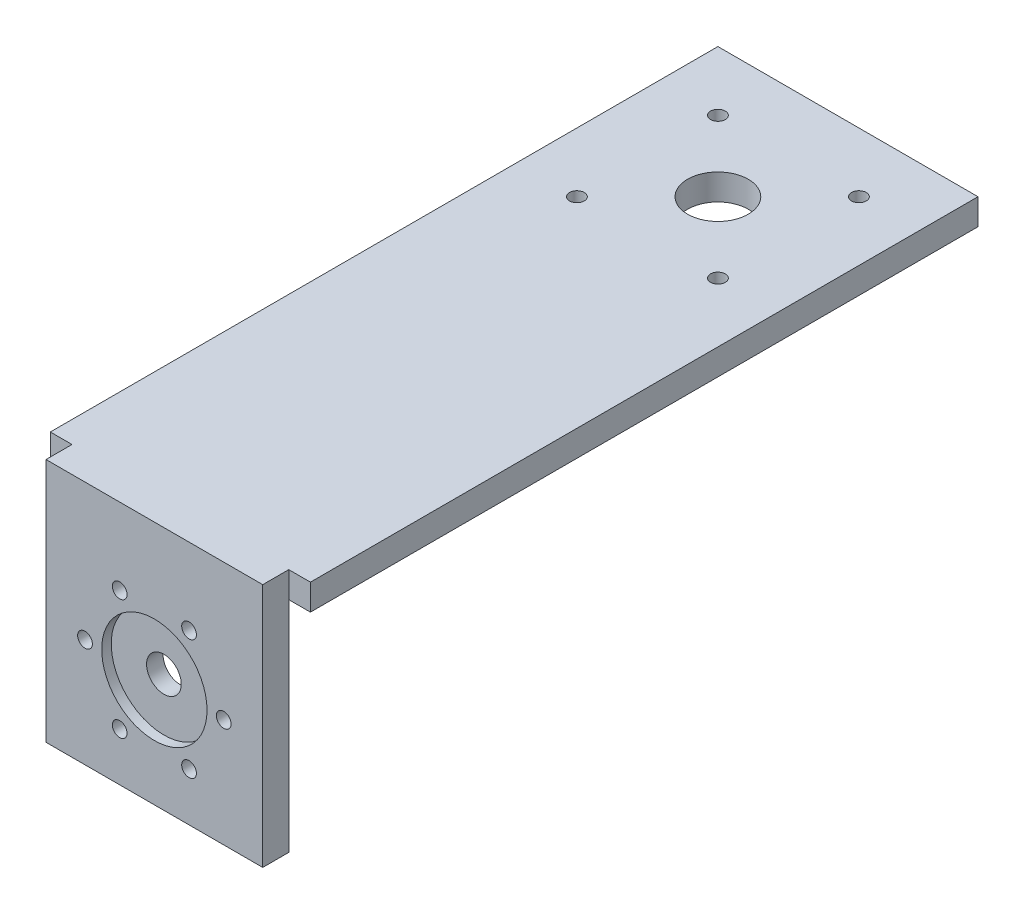
from build123d import *

# Parameters (mm, degrees)
SK_YAW_PLATE_W         = 50
SK_YAW_PLATE_H         = 56.5
SK_YAW_PLATE_R         = 1.7
SK_YAW_PLATE_R_2       = 4
YAW_PLATE_DEPTH        = 6
SK_YAW_PILOT_RECESS_R  = 12.15
YAW_PILOT_RECESS_DEPTH = 2.2
SK_ELBOW_PLATE_W       = 60
SK_ELBOW_PLATE_H       = 154
SK_ELBOW_PLATE_R       = 1.7
SK_ELBOW_PLATE_R_2     = 7
ELBOW_PLATE_DEPTH      = 6


with BuildPart() as part:
    # SK_Yaw_Plate → Yaw_Plate (new body)
    with BuildSketch(Plane.XY.offset(-6)):
        with Locations((0, 3.25)):
            Rectangle(SK_YAW_PLATE_W, SK_YAW_PLATE_H)
        with Locations((16, 0)):
            Circle(SK_YAW_PLATE_R, mode=Mode.SUBTRACT)
        with Locations((8, -13.856406461)):
            Circle(SK_YAW_PLATE_R, mode=Mode.SUBTRACT)
        with Locations((-8, -13.856406461)):
            Circle(SK_YAW_PLATE_R, mode=Mode.SUBTRACT)
        with Locations((-16, 0)):
            Circle(SK_YAW_PLATE_R, mode=Mode.SUBTRACT)
        with Locations((-8, 13.856406461)):
            Circle(SK_YAW_PLATE_R, mode=Mode.SUBTRACT)
        with Locations((8, 13.856406461)):
            Circle(SK_YAW_PLATE_R, mode=Mode.SUBTRACT)
        Circle(SK_YAW_PLATE_R_2, mode=Mode.SUBTRACT)
    extrude(amount=YAW_PLATE_DEPTH)

    # SK_Yaw_Pilot_Recess → Yaw_Pilot_Recess (cut)
    with BuildSketch(Plane.XY):
        Circle(SK_YAW_PILOT_RECESS_R)
    extrude(amount=-YAW_PILOT_RECESS_DEPTH, mode=Mode.SUBTRACT)

    # SK_Elbow_Plate → Elbow_Plate (add)
    with BuildSketch(Plane(origin=(0, 25.5, 0), x_dir=(1, 0, 0), z_dir=(0, 1, 0))):
        with Locations((0, 83)):
            Rectangle(SK_ELBOW_PLATE_W, SK_ELBOW_PLATE_H)
        with Locations(Location((16.263455967, 146.263455967, 0), (0, 0, 270))):
            Circle(SK_ELBOW_PLATE_R, mode=Mode.SUBTRACT)
        with Locations(Location((-16.263455967, 146.263455967, 0), (0, 0, 270))):
            Circle(SK_ELBOW_PLATE_R, mode=Mode.SUBTRACT)
        with Locations(Location((-16.263455967, 113.736544033, 0), (0, 0, 270))):
            Circle(SK_ELBOW_PLATE_R, mode=Mode.SUBTRACT)
        with Locations(Location((16.263455967, 113.736544033, 0), (0, 0, 270))):
            Circle(SK_ELBOW_PLATE_R, mode=Mode.SUBTRACT)
        with Locations(Location((0, 130, 0), (0, 0, 270))):
            Circle(SK_ELBOW_PLATE_R_2, mode=Mode.SUBTRACT)
    extrude(amount=ELBOW_PLATE_DEPTH)


solid = part.part
